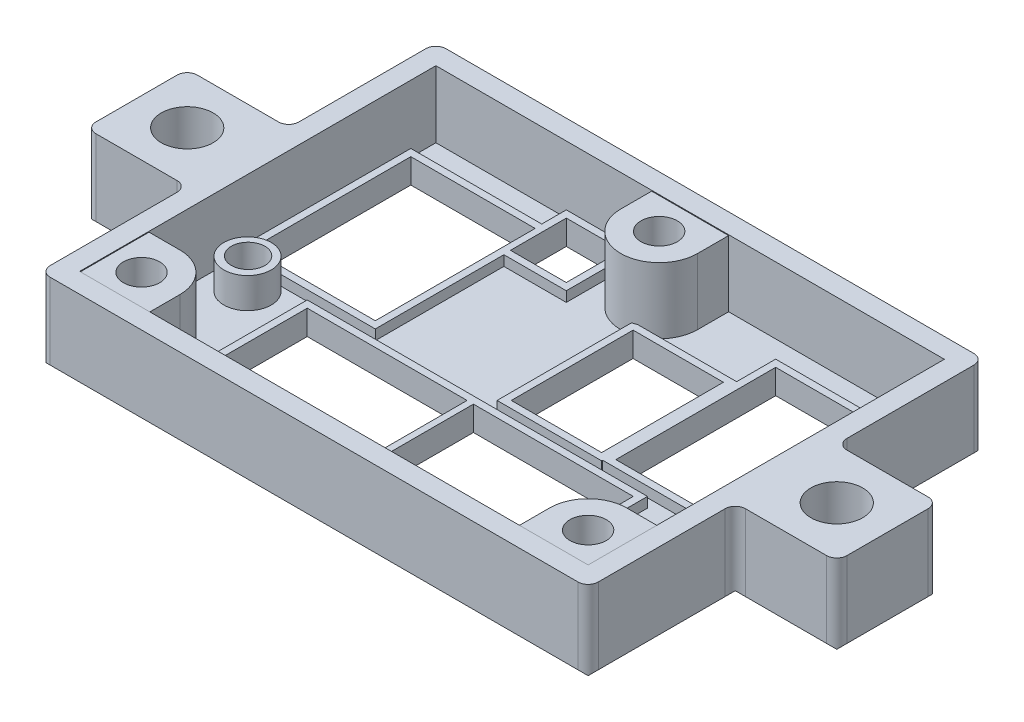
from build123d import *

# Parameters (mm, degrees)
SKETCH1_W           = 54
SKETCH1_H           = 39
SKETCH1_W_2         = 10
SKETCH1_H_2         = 10
SKETCH1_R           = 2.5527
BOSS_EXTRUDE1_DEPTH = 8
SKETCH2_W           = 50.1
SKETCH2_H           = 35.1
CUT_EXTRUDE1_DEPTH  = 0.0762
CUT_EXTRUDE2_DEPTH  = 6.5
SKETCH4_R           = 1.56
CUT_EXTRUDE3_DEPTH  = 43.568023286
SKETCH5_R           = 1.79
CUT_EXTRUDE4_DEPTH  = 2.92
SKETCH6_W           = 12.25
SKETCH6_H           = 15.75
SKETCH6_W_2         = 15.75
SKETCH6_H_2         = 12.5
SKETCH6_W_3         = 5.5
SKETCH6_H_3         = 5.5
CUT_EXTRUDE5_DEPTH  = 43.337883821
SKETCH7_W           = 8.9
SKETCH7_H           = 12
CUT_EXTRUDE6_DEPTH  = 43.337883821
CHAMFER1_SIZE       = 0.5
SKETCH9_R           = 1.651
CUT_EXTRUDE8_DEPTH  = 43.337883821
BOSS_EXTRUDE2_START = 3
SKETCH10_R          = 2.3375
SKETCH10_R_2        = 1.651
BOSS_EXTRUDE2_DEPTH = 3
SKETCH11_W          = 5.5
SKETCH11_H          = 5.5
SKETCH11_W_2        = 12.25
SKETCH11_H_2        = 15.75
SKETCH11_W_3        = 8.9
SKETCH11_H_3        = 12
SKETCH11_W_4        = 15.75
SKETCH11_H_4        = 12.5
BOSS_EXTRUDE3_DEPTH = 1
FILLET1_R           = 1


with BuildPart() as part:
    # Sketch1 → Boss-Extrude1 (new body)
    # profile 1 of 3: a face of its own
    with BuildSketch(Plane(origin=(0, 0, 0), x_dir=(1, 0, 0), z_dir=(0, 1, 0))):
        Rectangle(SKETCH1_W, SKETCH1_H)
    # profile 2 of 3: a face of its own
    with BuildSketch(Plane(origin=(0, 0, 0), x_dir=(1, 0, 0), z_dir=(0, 1, 0))):
        with Locations((32, 0)):
            Rectangle(SKETCH1_W_2, SKETCH1_H_2)
        with Locations(Location((32, 0, 0), (0, 0, 270))):
            Circle(SKETCH1_R, mode=Mode.SUBTRACT)
    # profile 3 of 3: a face of its own
    with BuildSketch(Plane(origin=(0, 0, 0), x_dir=(1, 0, 0), z_dir=(0, 1, 0))):
        with Locations((-32, 0)):
            Rectangle(SKETCH1_W_2, SKETCH1_H_2)
        with Locations(Location((-32, 0, 0), (0, 0, 270))):
            Circle(SKETCH1_R, mode=Mode.SUBTRACT)
    extrude(amount=BOSS_EXTRUDE1_DEPTH)

    # Sketch2 → Cut-Extrude1 (cut)
    with BuildSketch(Plane(origin=(0, 8, 0), x_dir=(1, 0, 0), z_dir=(0, 1, 0))):
        Rectangle(SKETCH2_W, SKETCH2_H)
    extrude(amount=-CUT_EXTRUDE1_DEPTH, mode=Mode.SUBTRACT)

    # Sketch3 → Cut-Extrude2 (cut)
    with BuildSketch(Plane(origin=(0, 7.9238, 0), x_dir=(1, 0, 0), z_dir=(0, 1, 0))):
        with BuildLine():
            Line((-3.79, 14.5), (-3.79, 17.55))
            Line((-3.79, 17.55), (-25.05, 17.55))
            Line((-25.05, 17.55), (-25.05, -10.71))
            Line((-25.05, -10.71), (-22, -10.71))
            ThreePointArc((-22, -10.71), (-19.320065299, -11.820065299), (-18.21, -14.5))
            Line((-18.21, -14.5), (-18.21, -17.55))
            Line((-18.21, -17.55), (18.21, -17.55))
            Line((18.21, -17.55), (18.21, -14.5))
            ThreePointArc((18.21, -14.5), (19.320065299, -11.820065299), (22, -10.71))
            Line((22, -10.71), (25.05, -10.71))
            Line((25.05, -10.71), (25.05, 17.55))
            Line((25.05, 17.55), (3.79, 17.55))
            Line((3.79, 17.55), (3.79, 14.5))
            ThreePointArc((3.79, 14.5), (0, 10.71), (-3.79, 14.5))
        make_face()
    extrude(amount=-CUT_EXTRUDE2_DEPTH, mode=Mode.SUBTRACT)

    # Sketch4 → Cut-Extrude3 (cut, through all)
    with BuildSketch(Plane(origin=(0, 7.9238, 0), x_dir=(1, 0, 0), z_dir=(0, 1, 0))):
        with Locations(Location((0, 14.5, 0), (0, 0, 270))):
            Circle(SKETCH4_R)
        with Locations(Location((-22, -14.5, 0), (0, 0, 270))):
            Circle(SKETCH4_R)
        with Locations(Location((22, -14.5, 0), (0, 0, 90))):
            Circle(SKETCH4_R)
    extrude(amount=-CUT_EXTRUDE3_DEPTH, mode=Mode.SUBTRACT)

    # Sketch5 → Cut-Extrude4 (cut)
    with BuildSketch(Plane(origin=(0, 7.9238, 0), x_dir=(1, 0, 0), z_dir=(0, 1, 0))):
        with Locations(Location((0, 14.5, 0), (0, 0, 270))):
            Circle(SKETCH5_R)
        with Locations(Location((-22, -14.5, 0), (0, 0, 270))):
            Circle(SKETCH5_R)
        with Locations(Location((22, -14.5, 0), (0, 0, 90))):
            Circle(SKETCH5_R)
    extrude(amount=-CUT_EXTRUDE4_DEPTH, mode=Mode.SUBTRACT)

    # Sketch6 → Cut-Extrude5 (cut, through all)
    with BuildSketch(Plane(origin=(0, 1.4238, 0), x_dir=(1, 0, 0), z_dir=(0, 1, 0))):
        with Locations((17.975, 6.255)):
            Rectangle(SKETCH6_W, SKETCH6_H)
        with Locations((7.975, -10.15)):
            Rectangle(SKETCH6_W_2, SKETCH6_H_2)
        with Locations((-17.975, 6.255)):
            Rectangle(SKETCH6_W, SKETCH6_H)
        with Locations((-8.4, -10.15)):
            Rectangle(SKETCH6_W_2, SKETCH6_H_2)
        with Locations((-8.45, 13.8)):
            Rectangle(SKETCH6_W_3, SKETCH6_H_3)
    extrude(amount=-CUT_EXTRUDE5_DEPTH, mode=Mode.SUBTRACT)

    # Sketch7 → Cut-Extrude6 (cut, through all)
    with BuildSketch(Plane(origin=(0, 1.4238, 0), x_dir=(1, 0, 0), z_dir=(0, 1, 0))):
        with Locations((6.1, 4.28)):
            Rectangle(SKETCH7_W, SKETCH7_H)
    extrude(amount=-CUT_EXTRUDE6_DEPTH, mode=Mode.SUBTRACT)

    # Chamfer1
    chamfer1_edges = [part.edges().sort_by_distance(p)[0] for p in [
        (-27, 0, 12.25),
        (-32, 0, 5),
        (-37, 0, 0),
        (-32, 0, -5),
        (-27, 0, -12.25),
        (0, 0, -19.5),
        (27, 0, -12.25),
        (32, 0, -5),
        (37, 0, 0),
        (32, 0, 5),
        (27, 0, 12.25),
        (0, 0, 19.5),
    ]]
    chamfer(chamfer1_edges, length=CHAMFER1_SIZE)

    # Sketch9 → Cut-Extrude8 (cut, through all)
    with BuildSketch(Plane(origin=(0, 1.4238, 0), x_dir=(1, 0, 0), z_dir=(0, 1, 0))):
        with Locations(Location((-21.65, -4.35, 0), (0, 0, 270))):
            Circle(SKETCH9_R)
    extrude(amount=-CUT_EXTRUDE8_DEPTH, mode=Mode.SUBTRACT)

    # Sketch10 → Boss-Extrude2 (add)
    with BuildSketch(Plane(origin=(0, 1.4238, 0), x_dir=(1, 0, 0), z_dir=(0, 1, 0)).offset(BOSS_EXTRUDE2_START)):
        with Locations(Location((-21.65, -4.406538836, 0), (0, 0, 270))):
            Circle(SKETCH10_R)
        with Locations(Location((-21.65, -4.35, 0), (0, 0, 270))):
            Circle(SKETCH10_R_2, mode=Mode.SUBTRACT)
    extrude(amount=-BOSS_EXTRUDE2_DEPTH)

    # Sketch11 → Boss-Extrude3 (add)
    # profile 1 of 3: a face of its own
    with BuildSketch(Plane(origin=(0, 1.4238, 0), x_dir=(1, 0, 0), z_dir=(0, 1, 0))):
        Polygon((-11.15, -2.32), (-11.15, 10.35), (-5, 10.35), (-5, 17.25), (-11.9, 17.25), (-11.9, 14.83), (-24.8, 14.83), (-24.8, -2.32), align=None)
        with Locations((-8.45, 13.8)):
            Rectangle(SKETCH11_W, SKETCH11_H, mode=Mode.SUBTRACT)
        with Locations((-17.975, 6.255)):
            Rectangle(SKETCH11_W_2, SKETCH11_H_2, mode=Mode.SUBTRACT)
    # profile 2 of 3: a face of its own
    with BuildSketch(Plane(origin=(0, 1.4238, 0), x_dir=(1, 0, 0), z_dir=(0, 1, 0))):
        Polygon((0.95, 10.98), (0.95, -2.42), (11.25, -2.42), (11.25, -2.32), (24.8, -2.32), (24.8, 14.83), (11.15, 14.83), (11.15, 10.98), align=None)
        with Locations((17.975, 6.255)):
            Rectangle(SKETCH11_W_2, SKETCH11_H_2, mode=Mode.SUBTRACT)
        with Locations((6.1, 4.28)):
            Rectangle(SKETCH11_W_3, SKETCH11_H_3, mode=Mode.SUBTRACT)
    # profile 3 of 3: a face of its own
    with BuildSketch(Plane(origin=(0, 1.4238, 0), x_dir=(1, 0, 0), z_dir=(0, 1, 0))):
        Polygon((16.55, -3.2), (0.175, -3.2), (-16.975, -3.2), (-16.975, -17.1), (0.175, -17.1), (16.55, -17.1), align=None)
        with Locations((7.975, -10.15)):
            Rectangle(SKETCH11_W_4, SKETCH11_H_4, mode=Mode.SUBTRACT)
        with Locations((-8.4, -10.15)):
            Rectangle(SKETCH11_W_4, SKETCH11_H_4, mode=Mode.SUBTRACT)
    extrude(amount=BOSS_EXTRUDE3_DEPTH)

    # Fillet1
    fillet1_edges = [part.edges().sort_by_distance(p)[0] for p in [
        (-27, 4.25, 19.5),
        (-27, 4.25, 5),
        (-37, 4.25, 5),
        (-37, 4.25, -5),
        (-27, 4.25, -5),
        (-27, 4.25, -19.5),
        (27, 4.25, -19.5),
        (27, 4.25, -5),
        (37, 4.25, -5),
        (37, 4.25, 5),
        (27, 4.25, 5),
        (27, 4.25, 19.5),
    ]]
    fillet(fillet1_edges, radius=FILLET1_R)


solid = part.part
